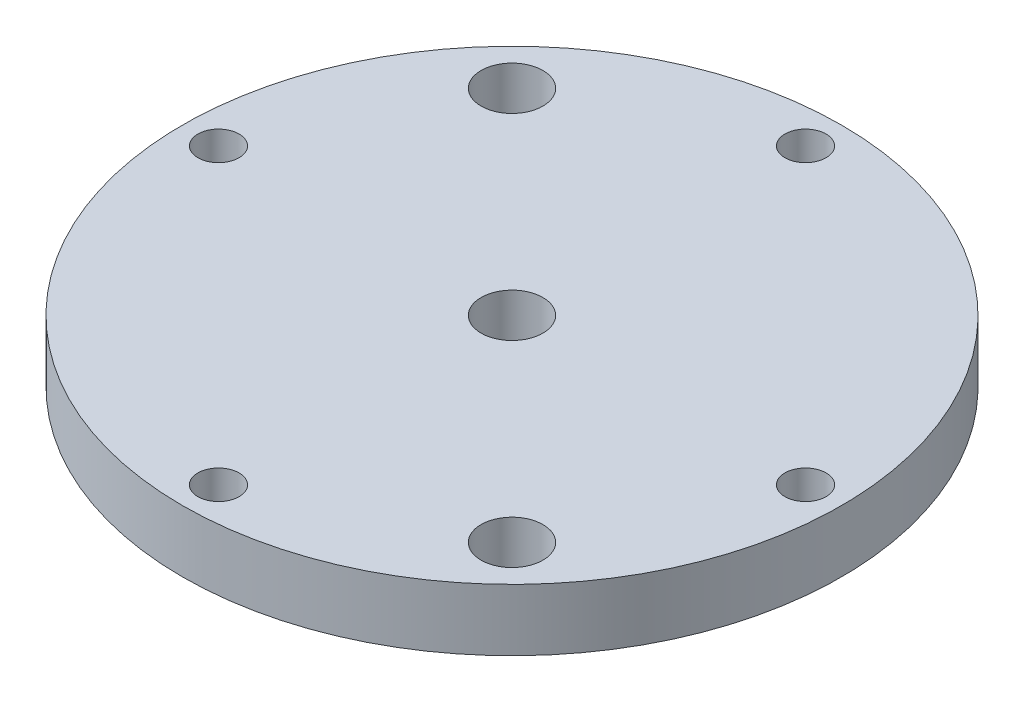
from build123d import *

# Parameters (mm, degrees)
ESBO_O1_R                = 32
ESBO_O1_R_2              = 3
ESBO_O1_R_3              = 2
RESSALTO_EXTRUS_O3_DEPTH = 6


with BuildPart() as part:
    # Esboço1 → Ressalto-extrusão3 (new body)
    with BuildSketch(Plane(origin=(0, 0, 0), x_dir=(1, 0, 0), z_dir=(0, 1, 0))):
        with Locations(Location((0, 0, 0), (0, 0, 270))):
            Circle(ESBO_O1_R)
        with Locations(Location((0, 0, 0), (0, 0, 270))):
            Circle(ESBO_O1_R_2, mode=Mode.SUBTRACT)
        with Locations(Location((0, 28.5, 0), (0, 0, 270))):
            Circle(ESBO_O1_R_3, mode=Mode.SUBTRACT)
        with Locations(Location((28.5, 0, 0), (0, 0, 270))):
            Circle(ESBO_O1_R_3, mode=Mode.SUBTRACT)
        with Locations(Location((0, -28.5, 0), (0, 0, 270))):
            Circle(ESBO_O1_R_3, mode=Mode.SUBTRACT)
        with Locations(Location((-28.5, 0, 0), (0, 0, 270))):
            Circle(ESBO_O1_R_3, mode=Mode.SUBTRACT)
        with Locations(Location((-19.091883092, 19.091883092, 0), (0, 0, 270))):
            Circle(ESBO_O1_R_2, mode=Mode.SUBTRACT)
        with Locations(Location((19.091883092, -19.091883092, 0), (0, 0, 270))):
            Circle(ESBO_O1_R_2, mode=Mode.SUBTRACT)
    extrude(amount=RESSALTO_EXTRUS_O3_DEPTH)


solid = part.part
